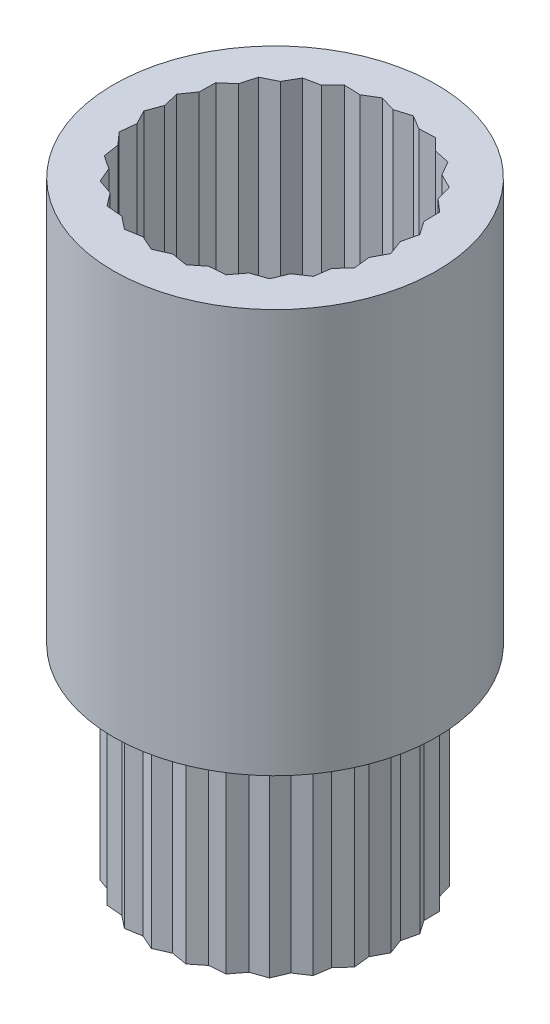
from build123d import *

# Parameters (mm, degrees)
BOSS_EXTRUDE2_DEPTH = 5
SKETCH2_R           = 4
BOSS_EXTRUDE3_DEPTH = 10
CUT_EXTRUDE4_DEPTH  = 5


with BuildPart() as part:
    # Sketch1 → Boss-Extrude2 (new body)
    with BuildSketch(Plane(origin=(0, 0, 0), x_dir=(1, 0, 0), z_dir=(0, 1, 0))):
        Polygon((0, 2.925), (-0.384146361, 3.04083156), (-0.72741792, 2.833105746), (-1.128301754, 2.849764929), (-1.409129497, 2.563197039), (-1.801561798, 2.479637088), (-2.002300285, 2.132233235), (-2.361623089, 1.953704529), (-2.469659182, 1.567293375), (-2.773294916, 1.305013529), (-2.78184031, 0.903874709), (-3.010710423, 0.574323729), (-2.919228181, 0.18366227), (-3.058951923, -0.192452942), (-2.873190208, -0.548090345), (-2.914988222, -0.947137088), (-2.646619128, -1.245404428), (-2.587865092, -1.642309127), (-2.253751235, -1.86446517), (-2.09813688, -2.234288843), (-1.719271863, -2.366374709), (-1.476575011, -2.685879974), (-1.076764317, -2.719596221), (-0.762234504, -2.968707389), (-0.366599708, -2.901935501), (0, -3.065), (0.366599708, -2.901935501), (0.762234504, -2.968707389), (1.076764317, -2.719596221), (1.476575011, -2.685879974), (1.719271863, -2.366374709), (2.09813688, -2.234288843), (2.253751235, -1.86446517), (2.587865092, -1.642309127), (2.646619128, -1.245404428), (2.914988222, -0.947137088), (2.873190208, -0.548090345), (3.058951923, -0.192452942), (2.919228181, 0.18366227), (3.010710423, 0.574323729), (2.78184031, 0.903874709), (2.773294916, 1.305013529), (2.469659182, 1.567293375), (2.361623089, 1.953704529), (2.002300285, 2.132233235), (1.801561798, 2.479637088), (1.409129497, 2.563197039), (1.128301754, 2.849764929), (0.72741792, 2.833105746), (0.384146361, 3.04083156), align=None)
    extrude(amount=BOSS_EXTRUDE2_DEPTH)

    # Sketch2 → Boss-Extrude3 (add)
    with BuildSketch(Plane(origin=(0, 5, 0), x_dir=(1, 0, 0), z_dir=(0, 1, 0))):
        with Locations(Location((0, 0, 0), (0, 0, 270))):
            Circle(SKETCH2_R)
    extrude(amount=BOSS_EXTRUDE3_DEPTH)

    # Sketch3 → Cut-Extrude4 (cut)
    with BuildSketch(Plane(origin=(0, 15, 0), x_dir=(1, 0, 0), z_dir=(0, 1, 0))):
        Polygon((-0.72741792, 2.833105746), (-0.384146361, 3.04083156), (0, 2.925), (0.384146361, 3.04083156), (0.72741792, 2.833105746), (1.128301754, 2.849764929), (1.409129497, 2.563197039), (1.801561798, 2.479637088), (2.002300285, 2.132233235), (2.361623089, 1.953704529), (2.469659182, 1.567293375), (2.773294916, 1.305013529), (2.78184031, 0.903874709), (3.010710423, 0.574323729), (2.919228181, 0.18366227), (3.058951923, -0.192452942), (2.873190208, -0.548090345), (2.914988222, -0.947137088), (2.646619128, -1.245404428), (2.587865092, -1.642309127), (2.253751235, -1.86446517), (2.09813688, -2.234288843), (1.719271863, -2.366374709), (1.476575011, -2.685879974), (1.076764317, -2.719596221), (0.762234504, -2.968707389), (0.366599708, -2.901935501), (0, -3.065), (-0.366599708, -2.901935501), (-0.762234504, -2.968707389), (-1.076764317, -2.719596221), (-1.476575011, -2.685879974), (-1.719271863, -2.366374709), (-2.09813688, -2.234288843), (-2.253751235, -1.86446517), (-2.587865092, -1.642309127), (-2.646619128, -1.245404428), (-2.914988222, -0.947137088), (-2.873190208, -0.548090345), (-3.058951923, -0.192452942), (-2.919228181, 0.18366227), (-3.010710423, 0.574323729), (-2.78184031, 0.903874709), (-2.773294916, 1.305013529), (-2.469659182, 1.567293375), (-2.361623089, 1.953704529), (-2.002300285, 2.132233235), (-1.801561798, 2.479637088), (-1.409129497, 2.563197039), (-1.128301754, 2.849764929), align=None)
    extrude(amount=-CUT_EXTRUDE4_DEPTH, mode=Mode.SUBTRACT)


solid = part.part
